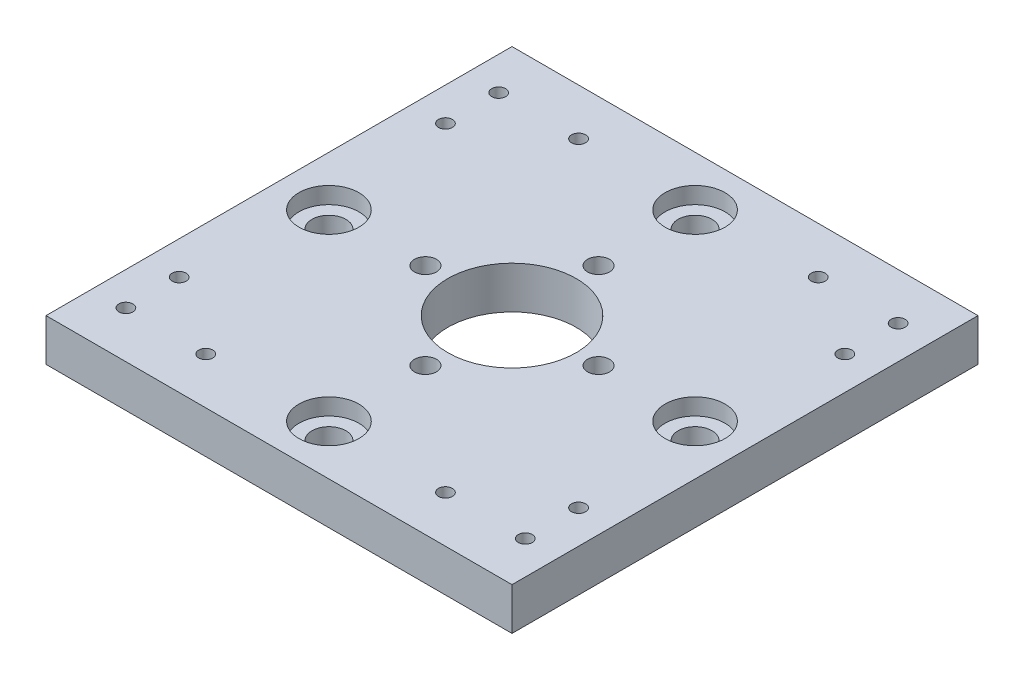
from build123d import *

# Parameters (mm, degrees)
SKETCH1_W           = 70
SKETCH1_H           = 70
SKETCH1_R           = 1.65
BOSS_EXTRUDE1_DEPTH = 6.35
CUT_EXTRUDE1_REACH  = 51.903
SKETCH2_R           = 1.05
CUT_EXTRUDE2_REACH  = 51.903
SKETCH3_R           = 9.65
CUT_EXTRUDE3_REACH  = 51.903
SKETCH4_R           = 2.55
SKETCH5_R           = 4.5
CUT_EXTRUDE4_DEPTH  = 2.5


with BuildPart() as part:
    # Sketch1 → Boss-Extrude1 (new body)
    with BuildSketch(Plane(origin=(0, 0, 0), x_dir=(1, 0, 0), z_dir=(0, 1, 0))):
        Rectangle(SKETCH1_W, SKETCH1_H)
        with Locations(Location((0, 13, 0), (0, 0, 270))):
            Circle(SKETCH1_R, mode=Mode.SUBTRACT)
        with Locations(Location((13, 0, 0), (0, 0, 270))):
            Circle(SKETCH1_R, mode=Mode.SUBTRACT)
        with Locations(Location((0, -13, 0), (0, 0, 270))):
            Circle(SKETCH1_R, mode=Mode.SUBTRACT)
        with Locations(Location((-13, 0, 0), (0, 0, 270))):
            Circle(SKETCH1_R, mode=Mode.SUBTRACT)
    extrude(amount=BOSS_EXTRUDE1_DEPTH)

    # Sketch2 → Cut-Extrude1 (cut, up to next)
    with BuildSketch(Plane(origin=(0, 6.35, 0), x_dir=(1, 0, 0), z_dir=(0, 1, 0)), mode=Mode.PRIVATE) as cut_extrude1_sk1:
        with Locations(Location((18, 28, 0), (0, 0, 270))):
            Circle(SKETCH2_R)
    cut_extrude1_tool1 = extrude(cut_extrude1_sk1.sketch, amount=-CUT_EXTRUDE1_REACH, mode=Mode.PRIVATE) & part.part
    # Sketch2 → Cut-Extrude1 (cut, up to next)
    with BuildSketch(Plane(origin=(0, 6.35, 0), x_dir=(1, 0, 0), z_dir=(0, 1, 0)), mode=Mode.PRIVATE) as cut_extrude1_sk2:
        with Locations(Location((30, 28, 0), (0, 0, 270))):
            Circle(SKETCH2_R)
    cut_extrude1_tool2 = extrude(cut_extrude1_sk2.sketch, amount=-CUT_EXTRUDE1_REACH, mode=Mode.PRIVATE) & part.part
    # Sketch2 → Cut-Extrude1 (cut, up to next)
    with BuildSketch(Plane(origin=(0, 6.35, 0), x_dir=(1, 0, 0), z_dir=(0, 1, 0)), mode=Mode.PRIVATE) as cut_extrude1_sk3:
        with Locations(Location((30, 20, 0), (0, 0, 270))):
            Circle(SKETCH2_R)
    cut_extrude1_tool3 = extrude(cut_extrude1_sk3.sketch, amount=-CUT_EXTRUDE1_REACH, mode=Mode.PRIVATE) & part.part
    # Sketch2 → Cut-Extrude1 (cut, up to next)
    with BuildSketch(Plane(origin=(0, 6.35, 0), x_dir=(1, 0, 0), z_dir=(0, 1, 0)), mode=Mode.PRIVATE) as cut_extrude1_sk4:
        with Locations(Location((-30, 20, 0), (0, 0, 270))):
            Circle(SKETCH2_R)
    cut_extrude1_tool4 = extrude(cut_extrude1_sk4.sketch, amount=-CUT_EXTRUDE1_REACH, mode=Mode.PRIVATE) & part.part
    # Sketch2 → Cut-Extrude1 (cut, up to next)
    with BuildSketch(Plane(origin=(0, 6.35, 0), x_dir=(1, 0, 0), z_dir=(0, 1, 0)), mode=Mode.PRIVATE) as cut_extrude1_sk5:
        with Locations(Location((-30, 28, 0), (0, 0, 270))):
            Circle(SKETCH2_R)
    cut_extrude1_tool5 = extrude(cut_extrude1_sk5.sketch, amount=-CUT_EXTRUDE1_REACH, mode=Mode.PRIVATE) & part.part
    # Sketch2 → Cut-Extrude1 (cut, up to next)
    with BuildSketch(Plane(origin=(0, 6.35, 0), x_dir=(1, 0, 0), z_dir=(0, 1, 0)), mode=Mode.PRIVATE) as cut_extrude1_sk6:
        with Locations(Location((-18, 28, 0), (0, 0, 270))):
            Circle(SKETCH2_R)
    cut_extrude1_tool6 = extrude(cut_extrude1_sk6.sketch, amount=-CUT_EXTRUDE1_REACH, mode=Mode.PRIVATE) & part.part
    # Sketch2 → Cut-Extrude1 (cut, up to next)
    with BuildSketch(Plane(origin=(0, 6.35, 0), x_dir=(1, 0, 0), z_dir=(0, 1, 0)), mode=Mode.PRIVATE) as cut_extrude1_sk7:
        with Locations(Location((30, -20, 0), (0, 0, 270))):
            Circle(SKETCH2_R)
    cut_extrude1_tool7 = extrude(cut_extrude1_sk7.sketch, amount=-CUT_EXTRUDE1_REACH, mode=Mode.PRIVATE) & part.part
    # Sketch2 → Cut-Extrude1 (cut, up to next)
    with BuildSketch(Plane(origin=(0, 6.35, 0), x_dir=(1, 0, 0), z_dir=(0, 1, 0)), mode=Mode.PRIVATE) as cut_extrude1_sk8:
        with Locations(Location((30, -28, 0), (0, 0, 270))):
            Circle(SKETCH2_R)
    cut_extrude1_tool8 = extrude(cut_extrude1_sk8.sketch, amount=-CUT_EXTRUDE1_REACH, mode=Mode.PRIVATE) & part.part
    # Sketch2 → Cut-Extrude1 (cut, up to next)
    with BuildSketch(Plane(origin=(0, 6.35, 0), x_dir=(1, 0, 0), z_dir=(0, 1, 0)), mode=Mode.PRIVATE) as cut_extrude1_sk9:
        with Locations(Location((18, -28, 0), (0, 0, 270))):
            Circle(SKETCH2_R)
    cut_extrude1_tool9 = extrude(cut_extrude1_sk9.sketch, amount=-CUT_EXTRUDE1_REACH, mode=Mode.PRIVATE) & part.part
    # Sketch2 → Cut-Extrude1 (cut, up to next)
    with BuildSketch(Plane(origin=(0, 6.35, 0), x_dir=(1, 0, 0), z_dir=(0, 1, 0)), mode=Mode.PRIVATE) as cut_extrude1_sk10:
        with Locations(Location((-18, -28, 0), (0, 0, 270))):
            Circle(SKETCH2_R)
    cut_extrude1_tool10 = extrude(cut_extrude1_sk10.sketch, amount=-CUT_EXTRUDE1_REACH, mode=Mode.PRIVATE) & part.part
    # Sketch2 → Cut-Extrude1 (cut, up to next)
    with BuildSketch(Plane(origin=(0, 6.35, 0), x_dir=(1, 0, 0), z_dir=(0, 1, 0)), mode=Mode.PRIVATE) as cut_extrude1_sk11:
        with Locations(Location((-30, -20, 0), (0, 0, 270))):
            Circle(SKETCH2_R)
    cut_extrude1_tool11 = extrude(cut_extrude1_sk11.sketch, amount=-CUT_EXTRUDE1_REACH, mode=Mode.PRIVATE) & part.part
    # Sketch2 → Cut-Extrude1 (cut, up to next)
    with BuildSketch(Plane(origin=(0, 6.35, 0), x_dir=(1, 0, 0), z_dir=(0, 1, 0)), mode=Mode.PRIVATE) as cut_extrude1_sk12:
        with Locations(Location((-30, -28, 0), (0, 0, 270))):
            Circle(SKETCH2_R)
    cut_extrude1_tool12 = extrude(cut_extrude1_sk12.sketch, amount=-CUT_EXTRUDE1_REACH, mode=Mode.PRIVATE) & part.part
    add(cut_extrude1_tool1.solids().sort_by_distance((18, 6.35, -28))[0], mode=Mode.SUBTRACT)
    add(cut_extrude1_tool2.solids().sort_by_distance((30, 6.35, -28))[0], mode=Mode.SUBTRACT)
    add(cut_extrude1_tool3.solids().sort_by_distance((30, 6.35, -20))[0], mode=Mode.SUBTRACT)
    add(cut_extrude1_tool4.solids().sort_by_distance((-30, 6.35, -20))[0], mode=Mode.SUBTRACT)
    add(cut_extrude1_tool5.solids().sort_by_distance((-30, 6.35, -28))[0], mode=Mode.SUBTRACT)
    add(cut_extrude1_tool6.solids().sort_by_distance((-18, 6.35, -28))[0], mode=Mode.SUBTRACT)
    add(cut_extrude1_tool7.solids().sort_by_distance((30, 6.35, 20))[0], mode=Mode.SUBTRACT)
    add(cut_extrude1_tool8.solids().sort_by_distance((30, 6.35, 28))[0], mode=Mode.SUBTRACT)
    add(cut_extrude1_tool9.solids().sort_by_distance((18, 6.35, 28))[0], mode=Mode.SUBTRACT)
    add(cut_extrude1_tool10.solids().sort_by_distance((-18, 6.35, 28))[0], mode=Mode.SUBTRACT)
    add(cut_extrude1_tool11.solids().sort_by_distance((-30, 6.35, 20))[0], mode=Mode.SUBTRACT)
    add(cut_extrude1_tool12.solids().sort_by_distance((-30, 6.35, 28))[0], mode=Mode.SUBTRACT)

    # Sketch3 → Cut-Extrude2 (cut, up to next)
    with BuildSketch(Plane(origin=(0, 6.35, 0), x_dir=(1, 0, 0), z_dir=(0, 1, 0)), mode=Mode.PRIVATE) as cut_extrude2_sk1:
        with Locations(Location((0, 0, 0), (0, 0, 270))):
            Circle(SKETCH3_R)
    cut_extrude2_tool1 = extrude(cut_extrude2_sk1.sketch, amount=-CUT_EXTRUDE2_REACH, mode=Mode.PRIVATE) & part.part
    add(cut_extrude2_tool1.solids().sort_by_distance((0, 6.35, 0))[0], mode=Mode.SUBTRACT)

    # Sketch4 → Cut-Extrude3 (cut, up to next)
    with BuildSketch(Plane(origin=(0, 6.35, 0), x_dir=(1, 0, 0), z_dir=(0, 1, 0)), mode=Mode.PRIVATE) as cut_extrude3_sk1:
        with Locations(Location((0, 27.5, 0), (0, 0, 270))):
            Circle(SKETCH4_R)
    cut_extrude3_tool1 = extrude(cut_extrude3_sk1.sketch, amount=-CUT_EXTRUDE3_REACH, mode=Mode.PRIVATE) & part.part
    # Sketch4 → Cut-Extrude3 (cut, up to next)
    with BuildSketch(Plane(origin=(0, 6.35, 0), x_dir=(1, 0, 0), z_dir=(0, 1, 0)), mode=Mode.PRIVATE) as cut_extrude3_sk2:
        with Locations(Location((27.5, 0, 0), (0, 0, 270))):
            Circle(SKETCH4_R)
    cut_extrude3_tool2 = extrude(cut_extrude3_sk2.sketch, amount=-CUT_EXTRUDE3_REACH, mode=Mode.PRIVATE) & part.part
    # Sketch4 → Cut-Extrude3 (cut, up to next)
    with BuildSketch(Plane(origin=(0, 6.35, 0), x_dir=(1, 0, 0), z_dir=(0, 1, 0)), mode=Mode.PRIVATE) as cut_extrude3_sk3:
        with Locations(Location((0, -27.5, 0), (0, 0, 270))):
            Circle(SKETCH4_R)
    cut_extrude3_tool3 = extrude(cut_extrude3_sk3.sketch, amount=-CUT_EXTRUDE3_REACH, mode=Mode.PRIVATE) & part.part
    # Sketch4 → Cut-Extrude3 (cut, up to next)
    with BuildSketch(Plane(origin=(0, 6.35, 0), x_dir=(1, 0, 0), z_dir=(0, 1, 0)), mode=Mode.PRIVATE) as cut_extrude3_sk4:
        with Locations(Location((-27.5, 0, 0), (0, 0, 270))):
            Circle(SKETCH4_R)
    cut_extrude3_tool4 = extrude(cut_extrude3_sk4.sketch, amount=-CUT_EXTRUDE3_REACH, mode=Mode.PRIVATE) & part.part
    add(cut_extrude3_tool1.solids().sort_by_distance((0, 6.35, -27.5))[0], mode=Mode.SUBTRACT)
    add(cut_extrude3_tool2.solids().sort_by_distance((27.5, 6.35, 0))[0], mode=Mode.SUBTRACT)
    add(cut_extrude3_tool3.solids().sort_by_distance((0, 6.35, 27.5))[0], mode=Mode.SUBTRACT)
    add(cut_extrude3_tool4.solids().sort_by_distance((-27.5, 6.35, 0))[0], mode=Mode.SUBTRACT)

    # Sketch5 → Cut-Extrude4 (cut)
    with BuildSketch(Plane(origin=(0, 6.35, 0), x_dir=(1, 0, 0), z_dir=(0, 1, 0))):
        with Locations(Location((0, 27.5, 0), (0, 0, 270))):
            Circle(SKETCH5_R)
        with Locations(Location((27.5, 0, 0), (0, 0, 270))):
            Circle(SKETCH5_R)
        with Locations(Location((0, -27.5, 0), (0, 0, 270))):
            Circle(SKETCH5_R)
        with Locations(Location((-27.5, 0, 0), (0, 0, 270))):
            Circle(SKETCH5_R)
    extrude(amount=-CUT_EXTRUDE4_DEPTH, mode=Mode.SUBTRACT)


solid = part.part
